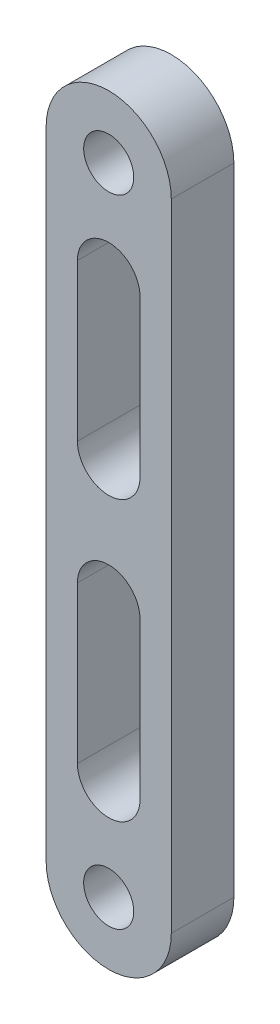
from build123d import *

# Parameters (mm, degrees)
SKETCH1_R           = 4
BOSS_EXTRUDE1_DEPTH = 10


with BuildPart() as part:
    # Sketch1 → Boss-Extrude1 (new body)
    with BuildSketch(Plane.XY):
        with BuildLine():
            Line((-10, -50.8), (-10, 50.8))
            ThreePointArc((-10, 50.8), (0, 60.8), (10, 50.8))
            Line((10, 50.8), (10, -50.8))
            ThreePointArc((10, -50.8), (0, -60.8), (-10, -50.8))
        make_face()
        with Locations((0, -50.8)):
            Circle(SKETCH1_R, mode=Mode.SUBTRACT)
        with Locations((0, 50.8)):
            Circle(SKETCH1_R, mode=Mode.SUBTRACT)
        with BuildLine():
            Line((-5, -34.8), (-5, -9.8))
            ThreePointArc((-5, -9.8), (0, -4.8), (5, -9.8))
            Line((5, -9.8), (5, -34.8))
            ThreePointArc((5, -34.8), (0, -39.8), (-5, -34.8))
        make_face(mode=Mode.SUBTRACT)
        with BuildLine():
            Line((5, 34.8), (5, 9.8))
            ThreePointArc((5, 9.8), (0, 4.8), (-5, 9.8))
            Line((-5, 9.8), (-5, 34.8))
            ThreePointArc((-5, 34.8), (0, 39.8), (5, 34.8))
        make_face(mode=Mode.SUBTRACT)
    extrude(amount=BOSS_EXTRUDE1_DEPTH)


solid = part.part
